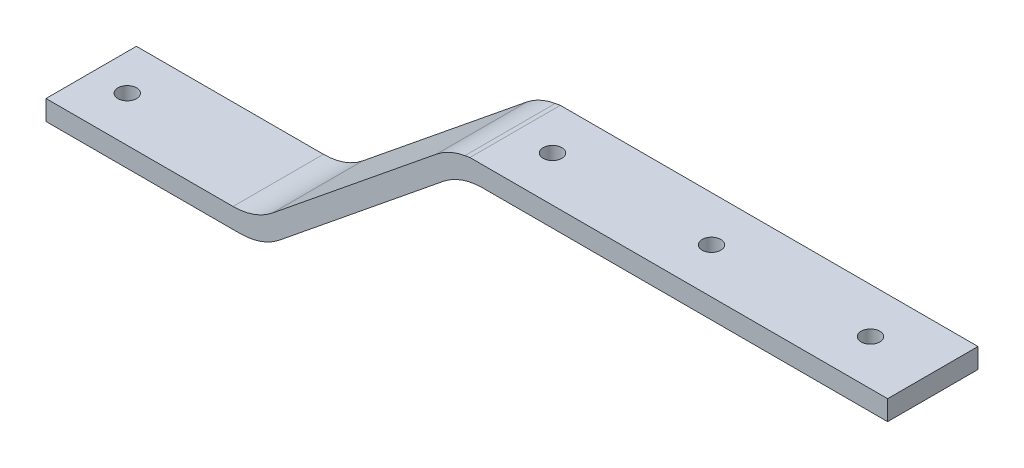
from build123d import *

# Parameters (mm, degrees)
BOSS_EXTRUDE1_DEPTH = 14.5
SKETCH3_R           = 1.5
CUT_EXTRUDE1_DEPTH  = 76.334255157


with BuildPart() as part:
    # Sketch2 → Boss-Extrude1 (new body)
    with BuildSketch(Plane.XY):
        with BuildLine():
            Line((0, 41.360359775), (67, 41.360359775))
            Line((67, 41.360359775), (67, 38.160359775))
            Line((67, 38.160359775), (2.044161335, 38.160359775))
            ThreePointArc((2.044161335, 38.160359775), (-1.29678146, 37.585756385), (-4.253780843, 35.927980024))
            Line((-4.253780843, 35.927980024), (-30.567780148, 14.592739527))
            ThreePointArc((-30.567780148, 14.592739527), (-33.524779531, 12.934963166), (-36.865722326, 12.360359775))
            Line((-36.865722326, 12.360359775), (-68, 12.360359775))
            Line((-68, 12.360359775), (-68, 15.560359775))
            Line((-68, 15.560359775), (-38, 15.560359775))
            ThreePointArc((-38, 15.560359775), (-34.659057205, 16.134963166), (-31.702057822, 17.792739527))
            Line((-31.702057822, 17.792739527), (-5.377247568, 39.13674548))
            ThreePointArc((-5.377247568, 39.13674548), (-3.225270493, 40.469178713), (-0.807686987, 41.218627608))
            Line((-0.807686987, 41.218627608), (0, 41.360359775))
        make_face()
    extrude(amount=BOSS_EXTRUDE1_DEPTH)

    # Sketch3 → Cut-Extrude1 (cut, through all)
    with BuildSketch(Plane(origin=(0, 41.360359775, 0), x_dir=(1, 0, 0), z_dir=(0, 1, 0))):
        with Locations(Location((6, -7.25, 0), (0, 0, 270))):
            Circle(SKETCH3_R)
        with Locations(Location((31.5, -7.25, 0), (0, 0, 270))):
            Circle(SKETCH3_R)
        with Locations(Location((57, -7.25, 0), (0, 0, 270))):
            Circle(SKETCH3_R)
        with Locations(Location((-62.214915759, -7.25, 0), (0, 0, 270))):
            Circle(SKETCH3_R)
    extrude(amount=-CUT_EXTRUDE1_DEPTH, mode=Mode.SUBTRACT)


solid = part.part
